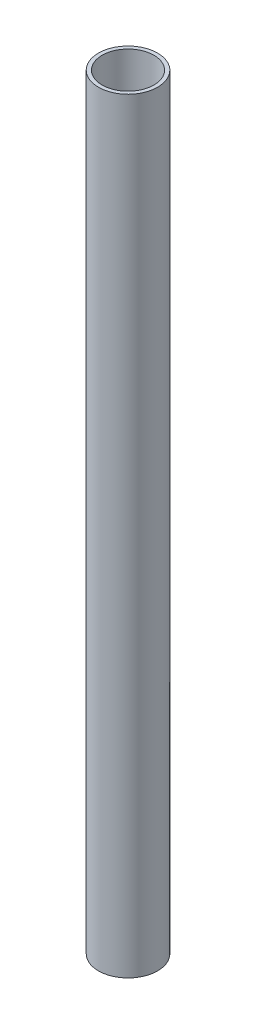
from build123d import *

# Parameters (mm, degrees)
SKETCH1_R           = 8
SKETCH1_R_2         = 7
BOSS_EXTRUDE1_DEPTH = 207


with BuildPart() as part:
    # Sketch1 → Boss-Extrude1 (new body)
    with BuildSketch(Plane(origin=(0, 0, 0), x_dir=(1, 0, 0), z_dir=(0, 1, 0))):
        with Locations(Location((0, 0, 0), (0, 0, 90))):
            Circle(SKETCH1_R)
        with Locations(Location((0, 0, 0), (0, 0, 90))):
            Circle(SKETCH1_R_2, mode=Mode.SUBTRACT)
    extrude(amount=BOSS_EXTRUDE1_DEPTH)


solid = part.part
